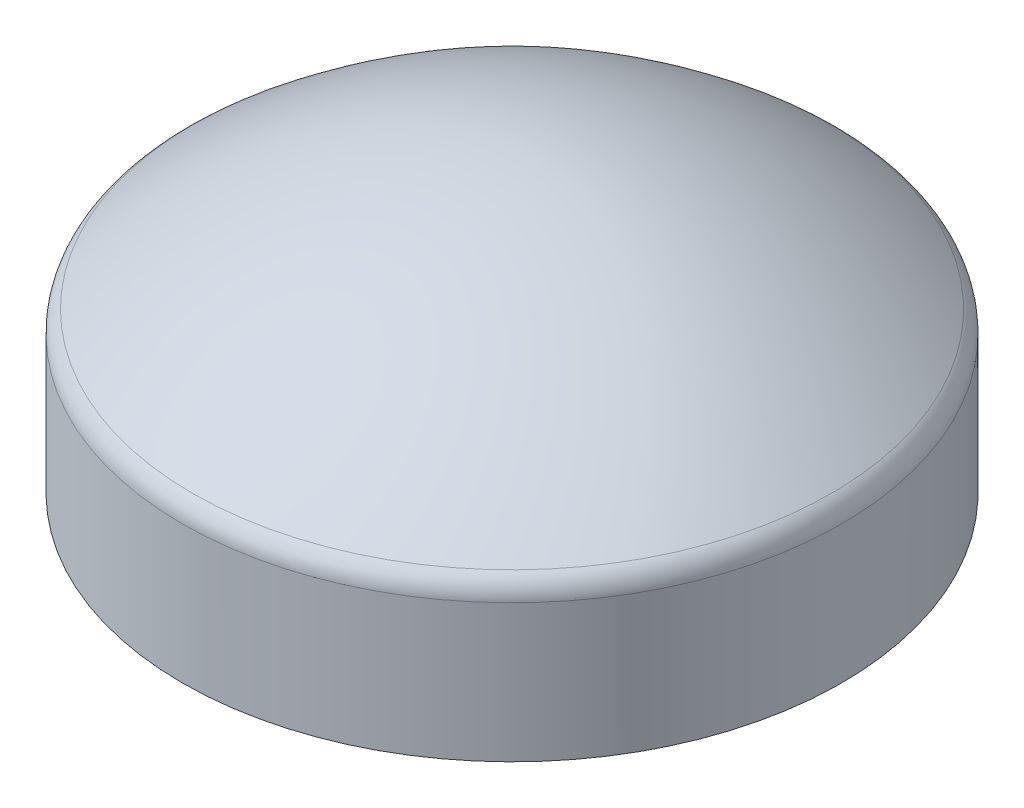
from build123d import *

# Parameters (mm, degrees)
FILLET1_R = 2


with BuildPart() as part:
    # Sketch1 → Revolve2 (revolve)
    with BuildSketch(Plane.XY, mode=Mode.PRIVATE) as revolve2_sk:
        with BuildLine():
            Line((-24.05, 0), (-22.6, 0))
            Line((-22.6, 0), (-22.6, 2.4))
            ThreePointArc((-22.6, 2.4), (-23.1, 2.9), (-22.6, 3.4))
            Line((-22.6, 3.4), (-22.6, 11))
            Line((-22.6, 11), (-22.05, 11))
            add(Edge.make_bspline(
                [(-22.05, 11), (-11.025, 19), (0, 19)],
                knots=[0, 0, 0, 0.5, 0.5, 0.5], degree=2))
            Line((0, 19), (0, 21))
            add(Edge.make_bspline(
                [(-24.05, 11), (-12.025, 21), (0, 21)],
                knots=[0, 0, 0, 0.5, 0.5, 0.5], degree=2))
            Line((-24.05, 11), (-24.05, 0))
        make_face()
    revolve(revolve2_sk.sketch.rotate(Axis((0, 21, 0), (0, -1, 0)), 270), axis=Axis((0, 21, 0), (0, -1, 0)))

    # Fillet1
    fillet1_edges = [part.edges().sort_by_distance(p)[0] for p in [
        (0, 11, -24.05),
    ]]
    fillet(fillet1_edges, radius=FILLET1_R)


solid = part.part
